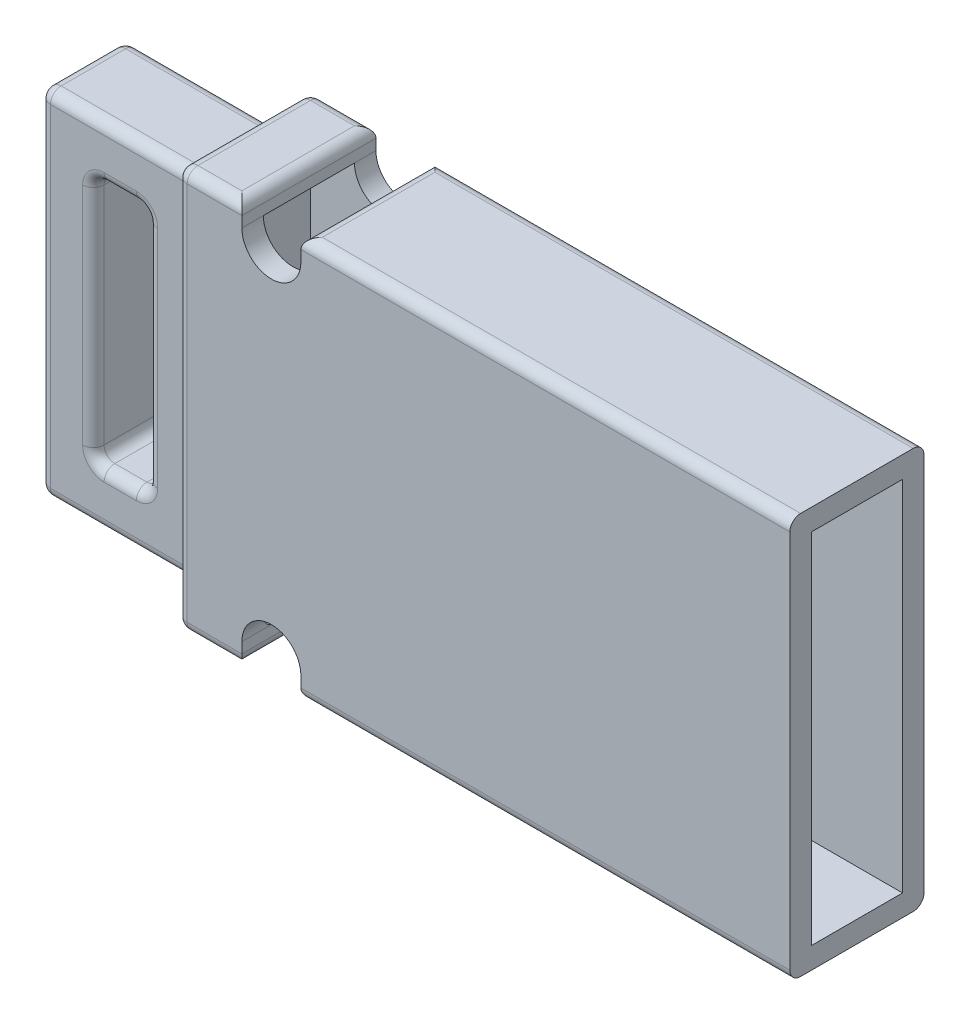
from build123d import *

# Parameters (mm, degrees)
SKETCH1_W           = 37.4
SKETCH1_H           = 57.2
BOSS_EXTRUDE1_DEPTH = 12.5
SHELL1_T            = -2
CUT_EXTRUDE1_DEPTH  = 70.475535262
SKETCH3_W           = 33
SKETCH3_H           = 8
BOSS_EXTRUDE2_DEPTH = 15
SKETCH4_W           = 5
SKETCH4_H           = 23
CUT_EXTRUDE2_DEPTH  = 82.955246934
FILLET2_R           = 1


with BuildPart() as part:
    # Sketch1 → Boss-Extrude1 (new body)
    with BuildSketch(Plane(origin=(0, 0, 0), x_dir=(0, 1, 0), z_dir=(0, 0, 1))):
        with Locations((-18.7, 28.6)):
            Rectangle(SKETCH1_W, SKETCH1_H)
    extrude(amount=BOSS_EXTRUDE1_DEPTH)

    # Shell1
    shell1_openings = [part.faces().sort_by_distance(p)[0] for p in [
        (0, -18.7, 6.25),
    ]]
    offset(amount=SHELL1_T, openings=shell1_openings, kind=Kind.INTERSECTION)

    # Sketch2 → Cut-Extrude1 (cut, through all)
    with BuildSketch(Plane.XY.offset(12.5)):
        with BuildLine():
            Line((-51.1, -37.4), (-51.1, -35.4))
            ThreePointArc((-51.1, -35.4), (-48.35, -32.65), (-45.6, -35.4))
            Line((-45.6, -35.4), (-45.6, -37.4))
            Line((-45.6, -37.4), (-51.1, -37.4))
        make_face()
        with BuildLine():
            Line((-51.1, 0), (-51.1, -2))
            ThreePointArc((-51.1, -2), (-48.35, -4.75), (-45.6, -2))
            Line((-45.6, -2), (-45.6, 0))
            Line((-45.6, 0), (-51.1, 0))
        make_face()
    extrude(amount=-CUT_EXTRUDE1_DEPTH, mode=Mode.SUBTRACT)

    # Sketch3 → Boss-Extrude2 (add)
    with BuildSketch(Plane(origin=(-57.2, 0, 0), x_dir=(0, -1, 0), z_dir=(-1, 0, 0))):
        with Locations((18.7, 6.25)):
            Rectangle(SKETCH3_W, SKETCH3_H)
    extrude(amount=BOSS_EXTRUDE2_DEPTH)

    # Sketch4 → Cut-Extrude2 (cut, through all)
    with BuildSketch(Plane(origin=(0, 0, 2.25), x_dir=(1, 0, 0), z_dir=(0, 0, -1))):
        with Locations((-64.7, 18.7)):
            Rectangle(SKETCH4_W, SKETCH4_H)
    extrude(amount=-CUT_EXTRUDE2_DEPTH, mode=Mode.SUBTRACT)

    # Fillet2
    fillet2_edges = [part.edges().sort_by_distance(p)[0] for p in [
        (-54.15, -37.4, 12.5),
        (-53.15, -35.4, 10.5),
        (-54.15, 0, 0),
        (-22.8, -37.4, 0),
        (-54.15, 0, 12.5),
        (-22.8, -37.4, 12.5),
        (-45.6, -37.4, 6.25),
        (-51.1, -37.4, 6.25),
        (-22.8, 0, 12.5),
        (-51.1, 0, 6.25),
        (-45.6, 0, 6.25),
        (-54.15, -37.4, 0),
        (-57.2, -18.7, 0),
        (-22.8, 0, 0),
        (-57.2, -35.2, 6.25),
        (-64.7, -35.2, 2.25),
        (-57.2, -18.7, 10.25),
        (-64.7, -35.2, 10.25),
        (-57.2, -2.2, 6.25),
        (-64.7, -2.2, 10.25),
        (-57.2, -18.7, 2.25),
        (-64.7, -2.2, 2.25),
        (-72.2, -35.2, 6.25),
        (-72.2, -18.7, 10.25),
        (-72.2, -2.2, 6.25),
        (-72.2, -18.7, 2.25),
        (-57.2, -37.4, 6.25),
        (-57.2, 0, 6.25),
        (-64.7, -7.2, 10.25),
        (-62.2, -7.2, 6.25),
        (-67.2, -18.7, 10.25),
        (-67.2, -7.2, 6.25),
        (-64.7, -30.2, 10.25),
        (-67.2, -30.2, 6.25),
        (-62.2, -18.7, 10.25),
        (-62.2, -30.2, 6.25),
        (-64.7, -7.2, 2.25),
        (-62.2, -18.7, 2.25),
        (-57.2, -18.7, 12.5),
        (-64.7, -30.2, 2.25),
        (-67.2, -18.7, 2.25),
    ]]
    fillet(fillet2_edges, radius=FILLET2_R)


solid = part.part
